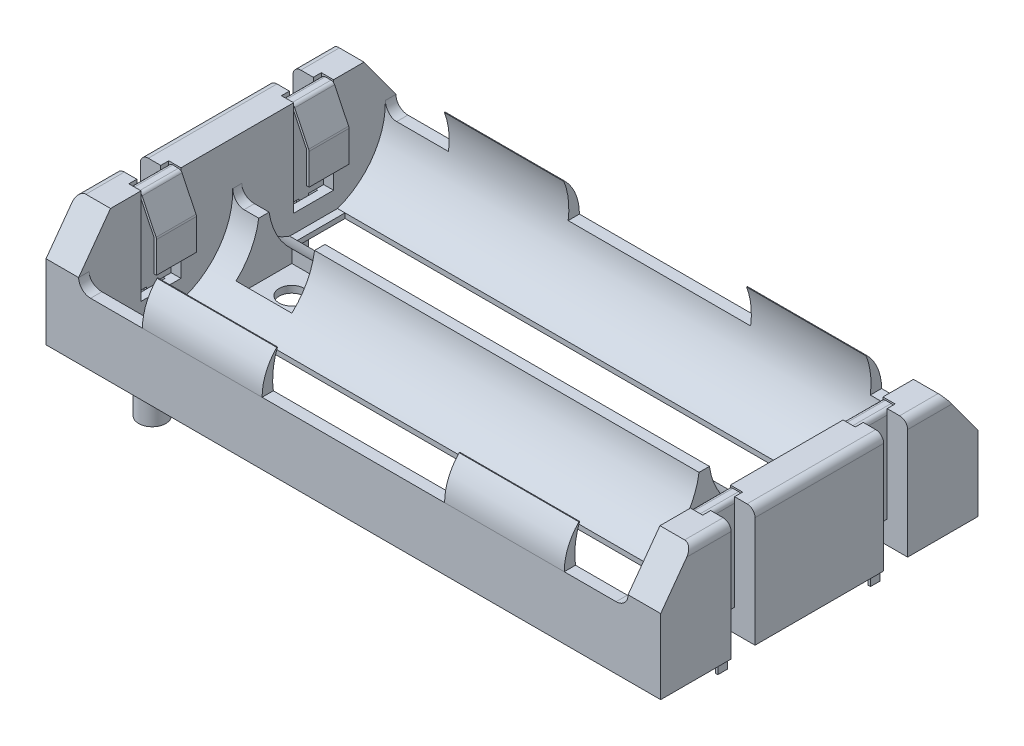
from build123d import *

# Parameters (mm, degrees)
SKETCH1_W               = 77.06
SKETCH1_H               = 14.85
BOSS_EXTRUDE1_DEPTH     = 19.89
CUT_EXTRUDE2_DEPTH      = 34.44
CUT_EXTRUDE2_DEPTH_BACK = 34.44
SKETCH2_R               = 9
CUT_EXTRUDE3_DEPTH      = 46.833344848
CUT_EXTRUDE4_REACH      = 71.55
CUT_EXTRUDE5_START      = -1.172295
SKETCH5_W               = 52.88
SKETCH5_H               = 4.5
CUT_EXTRUDE5_DEPTH      = 1.172295
CUT_EXTRUDE6_REACH      = 82.959
CUT_EXTRUDE7_START      = -72.97
CUT_EXTRUDE7_DEPTH      = 8.989114397
SKETCH7_W               = 67
SKETCH7_H               = 6
CUT_EXTRUDE8_DEPTH      = 46.833344892
SKETCH8_W               = 6
SKETCH8_H               = 0.614718626
BOSS_EXTRUDE2_DEPTH     = 0.94
BOSS_EXTRUDE3_START     = 67
SKETCH8_2_W             = 6
SKETCH8_2_H             = 0.614718626
BOSS_EXTRUDE3_DEPTH     = 0.94
FILLET1_R               = 1
SKETCH9_W               = 3.09
SKETCH9_H               = 3
CUT_EXTRUDE9_DEPTH      = 46.833344892
SKETCH10_W              = 1.53
SKETCH10_H              = 5
CUT_EXTRUDE10_DEPTH     = 12
EXTRUDE_THIN1_DEPTH     = 5
SKETCH12_W              = 1.2
SKETCH12_H              = 6.28
BOSS_EXTRUDE4_DEPTH     = 0.3
SKETCH13_W              = 7
SKETCH13_H              = 7
CUT_EXTRUDE11_DEPTH     = 7
SKETCH14_R              = 1.59
CUT_EXTRUDE12_DEPTH     = 46.565041468
SKETCH15_R              = 1.7
BOSS_EXTRUDE5_DEPTH     = 3.43


with BuildPart() as part:
    # Sketch1 → Boss-Extrude1 (new body)
    with BuildSketch(Plane.XY):
        with Locations((0, 7.425)):
            Rectangle(SKETCH1_W, SKETCH1_H)
    extrude(amount=BOSS_EXTRUDE1_DEPTH)

    # Sketch2 → Cut-Extrude2 (cut, two sides: drawn at the far end of the back side and taken through both)
    with BuildSketch(Plane(origin=(0, 0, 0), x_dir=(0, 0, -1), z_dir=(1, 0, 0)).offset(-CUT_EXTRUDE2_DEPTH_BACK)):
        with Locations((-9.565, 9.1)):
            Circle(SKETCH2_R)
    extrude(amount=CUT_EXTRUDE2_DEPTH + CUT_EXTRUDE2_DEPTH_BACK, mode=Mode.SUBTRACT)

    # Sketch3 → Cut-Extrude3 (cut, through all)
    with BuildSketch(Plane.XY.offset(19.89)):
        with BuildLine():
            Line((-34.44, 14.85), (-34.44, 9.35))
            ThreePointArc((-34.44, 9.35), (-34.000660172, 8.289339828), (-32.94, 7.85))
            Line((-32.94, 7.85), (-26.44, 7.85))
            Line((-26.44, 7.85), (-26.44, 12.35))
            Line((-26.44, 12.35), (-11.44, 12.35))
            Line((-11.44, 12.35), (-11.44, 7.85))
            Line((-11.44, 7.85), (11.44, 7.85))
            Line((11.44, 7.85), (11.44, 12.35))
            Line((11.44, 12.35), (26.44, 12.35))
            Line((26.44, 12.35), (26.44, 7.85))
            Line((26.44, 7.85), (32.94, 7.85))
            ThreePointArc((32.94, 7.85), (34.000660172, 8.289339828), (34.44, 9.35))
            Line((34.44, 9.35), (34.44, 14.85))
            Line((34.44, 14.85), (-34.44, 14.85))
        make_face()
    extrude(amount=-CUT_EXTRUDE3_DEPTH, mode=Mode.SUBTRACT)

    # Cut-Extrude4: up to this face of the body (flat: up to its plane)
    cut_extrude4_end = Plane(part.part.faces().sort_by_distance((26.44, 10.230262059, 19.141413454))[0])
    # Sketch4 → Cut-Extrude4 (cut, up to the picked face)
    with BuildSketch(Plane.ZY.offset(26.44), mode=Mode.PRIVATE) as cut_extrude4_sk1:
        with BuildLine():
            Line((19.89, 12.35), (19.89, 7.85))
            ThreePointArc((19.89, 7.85), (19.414367614, 10.279367426), (18.057705166, 12.35))
            Line((18.057705166, 12.35), (19.89, 12.35))
        make_face()
    cut_extrude4_tool1 = split(extrude(cut_extrude4_sk1.sketch, amount=-CUT_EXTRUDE4_REACH, mode=Mode.PRIVATE), bisect_by=cut_extrude4_end, keep=Keep.BOTH, mode=Mode.PRIVATE)
    add(cut_extrude4_tool1.solids().sort_by(Axis((-26.44, 11.259512, 19.356911), (1, 0, 0)))[0], mode=Mode.SUBTRACT)

    # Sketch5 → Cut-Extrude5 (cut)
    with BuildSketch(Plane(origin=(0, 0, 0), x_dir=(-1, 0, 0), z_dir=(0, 0, -1)).offset(CUT_EXTRUDE5_START)):
        with Locations((0, 10.1)):
            Rectangle(SKETCH5_W, SKETCH5_H)
    extrude(amount=CUT_EXTRUDE5_DEPTH, mode=Mode.SUBTRACT)

    # Sketch6 → Cut-Extrude6 (cut, up to next)
    with BuildSketch(Plane.ZY.offset(38.53), mode=Mode.PRIVATE) as cut_extrude6_sk1:
        Polygon((19.89, 9.35), (15.89, 14.85), (19.89, 14.85), align=None)
    cut_extrude6_tool1 = extrude(cut_extrude6_sk1.sketch, amount=-CUT_EXTRUDE6_REACH, mode=Mode.PRIVATE) & part.part
    add(cut_extrude6_tool1.solids().sort_by_distance((-38.53, 13.016667, 18.556667))[0], mode=Mode.SUBTRACT)

    # Sketch6<2> → Cut-Extrude7 (cut, through all)
    with BuildSketch(Plane.ZY.offset(38.53).offset(CUT_EXTRUDE7_START)):
        Polygon((19.89, 9.35), (15.89, 14.85), (19.89, 14.85), align=None)
    extrude(amount=-CUT_EXTRUDE7_DEPTH, mode=Mode.SUBTRACT)

    # Sketch7 → Cut-Extrude8 (cut, through all)
    with BuildSketch(Plane(origin=(0, 14.85, 0), x_dir=(1, 0, 0), z_dir=(0, 1, 0))):
        with Locations((0, -9.565)):
            Rectangle(SKETCH7_W, SKETCH7_H)
    extrude(amount=-CUT_EXTRUDE8_DEPTH, mode=Mode.SUBTRACT)

    # Sketch8 → Boss-Extrude2 (add)
    with BuildSketch(Plane(origin=(-33.5, 0, 0), x_dir=(0, 0, -1), z_dir=(1, 0, 0))):
        with Locations((-9.565, 0.307359313)):
            Rectangle(SKETCH8_W, SKETCH8_H)
    extrude(amount=-BOSS_EXTRUDE2_DEPTH)

    # Sketch8<2> → Boss-Extrude3 (add)
    with BuildSketch(Plane(origin=(-33.5, 0, 0), x_dir=(0, 0, -1), z_dir=(1, 0, 0)).offset(BOSS_EXTRUDE3_START)):
        with Locations((-9.565, 0.307359313)):
            Rectangle(SKETCH8_2_W, SKETCH8_2_H)
    extrude(amount=BOSS_EXTRUDE3_DEPTH)

    # Fillet1
    fillet1_edges = [part.edges().sort_by_distance(p)[0] for p in [
        (-38.53, 14.85, 7.945),
        (38.53, 14.85, 7.945),
    ]]
    fillet(fillet1_edges, radius=FILLET1_R)

    # Sketch9 → Cut-Extrude9 (cut, through all)
    with BuildSketch(Plane(origin=(0, 14.85, 0), x_dir=(1, 0, 0), z_dir=(0, 1, 0))):
        with Locations((36.985, -9.565)):
            Rectangle(SKETCH9_W, SKETCH9_H)
    cut_extrude9 = extrude(amount=-CUT_EXTRUDE9_DEPTH, mode=Mode.SUBTRACT)

    # Mirror1: Cut-Extrude9 across plane
    add(cut_extrude9.mirror(Plane(origin=(0, 0, 0), x_dir=(0, 0, 1), z_dir=(1, 0, 0))), mode=Mode.SUBTRACT)

    # Sketch10 → Cut-Extrude10 (cut)
    with BuildSketch(Plane(origin=(0, 14.85, 0), x_dir=(1, 0, 0), z_dir=(0, 1, 0))):
        with Locations((35.205, -9.565)):
            Rectangle(SKETCH10_W, SKETCH10_H)
    cut_extrude10 = extrude(amount=-CUT_EXTRUDE10_DEPTH, mode=Mode.SUBTRACT)

    # Mirror2: Cut-Extrude10 across plane
    add(cut_extrude10.mirror(Plane(origin=(0, 0, 0), x_dir=(0, 0, 1), z_dir=(1, 0, 0))), mode=Mode.SUBTRACT)

    # Mirror4: part across plane


with BuildPart() as body_2:
    # Sketch11 → Extrude-Thin1 (new body)
    with BuildSketch(Plane.XY.offset(7.065)):
        with BuildLine():
            Line((32.5, 6.65), (32.5, 10.535147664))
            ThreePointArc((32.5, 10.535147664), (32.512690988, 10.647084821), (32.550119708, 10.753339605))
            Line((32.550119708, 10.753339605), (34.303323092, 14.368191941))
            ThreePointArc((34.303323092, 14.368191941), (34.487775399, 14.573731029), (34.753203383, 14.65))
            Line((34.753203383, 14.65), (35.47, 14.65))
            ThreePointArc((35.47, 14.65), (35.823553391, 14.503553391), (35.97, 14.15))
            Line((35.97, 14.15), (35.97, 2.85))
            Line((35.97, 2.85), (35.67, 2.85))
            Line((35.67, 2.85), (35.67, 14.15))
            ThreePointArc((35.67, 14.15), (35.611421356, 14.291421356), (35.47, 14.35))
            Line((35.47, 14.35), (34.753203383, 14.35))
            ThreePointArc((34.753203383, 14.35), (34.64703219, 14.319492412), (34.573251266, 14.237276777))
            Line((34.573251266, 14.237276777), (32.820047883, 10.62242444))
            ThreePointArc((32.820047883, 10.62242444), (32.805076395, 10.579922526), (32.8, 10.535147664))
            Line((32.8, 10.535147664), (32.8, 6.65))
            Line((32.8, 6.65), (32.5, 6.65))
        make_face()
    extrude(amount=EXTRUDE_THIN1_DEPTH)

    # Sketch12 → Boss-Extrude4 (add)
    with BuildSketch(Plane(origin=(35.97, 0, 0), x_dir=(0, 0, -1), z_dir=(1, 0, 0))):
        with Locations((-9.565, -0.29)):
            Rectangle(SKETCH12_W, SKETCH12_H)
    extrude(amount=-BOSS_EXTRUDE4_DEPTH)


with BuildPart() as body_3:
    # Mirror3: mirrored copy
    add(body_2.part.mirror(Plane(origin=(0, 0, 0), x_dir=(0, 0, 1), z_dir=(1, 0, 0))))


with BuildPart() as part_1:
    add(part.part)
    add(part.part.mirror(Plane.XY))

    # Sketch13 → Cut-Extrude11 (cut)
    with BuildSketch(Plane(origin=(0, 7.85, 0), x_dir=(1, 0, 0), z_dir=(0, 1, 0))):
        with Locations((-27.6, 0)):
            Rectangle(SKETCH13_W, SKETCH13_H)
    cut_extrude11 = extrude(amount=-CUT_EXTRUDE11_DEPTH, mode=Mode.SUBTRACT)

    # Sketch14 → Cut-Extrude12 (cut, through all)
    with BuildSketch(Plane(origin=(0, 0.85, 0), x_dir=(1, 0, 0), z_dir=(0, 1, 0))):
        with Locations(Location((-27.6, 0, 0), (0, 0, 270))):
            Circle(SKETCH14_R)
    cut_extrude12 = extrude(amount=-CUT_EXTRUDE12_DEPTH, mode=Mode.SUBTRACT)

    # Mirror6: Cut-Extrude11, Cut-Extrude12 across plane
    add(cut_extrude11.mirror(Plane(origin=(0, 0, 0), x_dir=(0, 0, 1), z_dir=(1, 0, 0))), mode=Mode.SUBTRACT)
    add(cut_extrude12.mirror(Plane(origin=(0, 0, 0), x_dir=(0, 0, 1), z_dir=(1, 0, 0))), mode=Mode.SUBTRACT)

    # Sketch15 → Boss-Extrude5 (add, through all)
    with BuildSketch(Plane.XZ):
        with Locations(Location((-27.6, 17.5, 0), (0, 0, 90))):
            Circle(SKETCH15_R)
        with Locations(Location((27.6, -17.5, 0), (0, 0, 90))):
            Circle(SKETCH15_R)
    extrude(amount=BOSS_EXTRUDE5_DEPTH)


with BuildPart() as body_4:
    # Mirror5: mirrored copy
    add(body_2.part.mirror(Plane.XY))


with BuildPart() as body_5:
    # Mirror5 2: mirrored copy
    add(body_3.part.mirror(Plane.XY))


solid = Compound([body_2.part, body_3.part, part_1.part, body_4.part, body_5.part])
